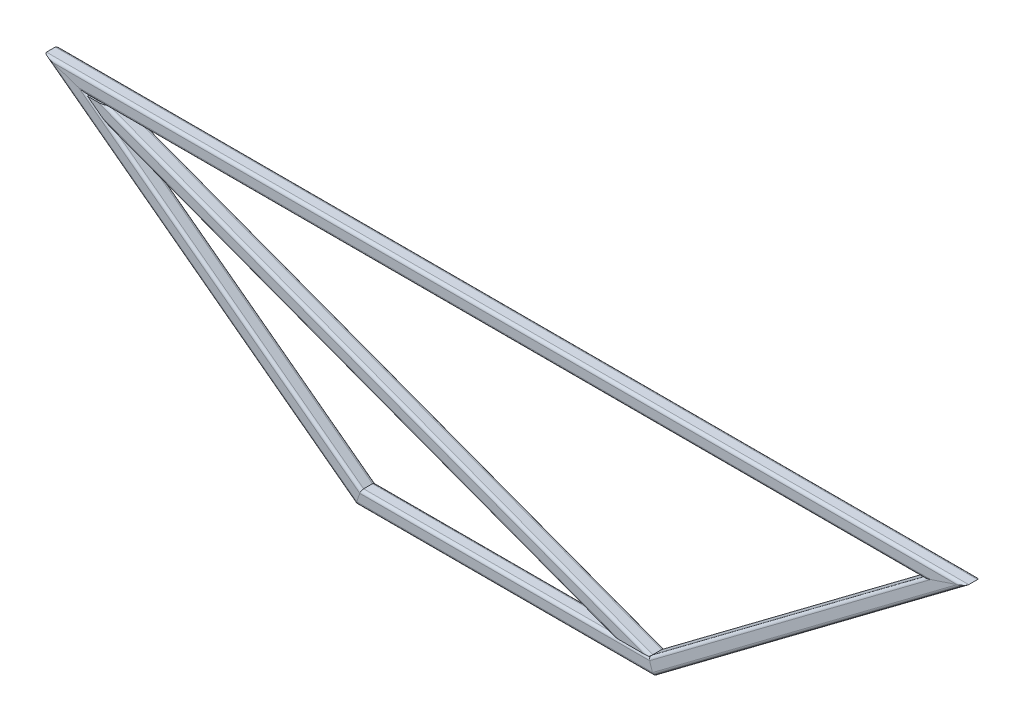
from build123d import *

# Parameters (mm, degrees)
SQUARE_TUBE_20_X_20_X_2_2_DEPTH      = 1243.426406871
SQUARE_TUBE_20_X_20_X_2_2_DEPTH_BACK = 43.426406871
SQUARE_TUBE_20_X_20_X_2_2_2_DEPTH    = 549.140452079
SQUARE_TUBE_20_X_20_X_2_2_3_DEPTH    = 411.428090416
SQUARE_TUBE_20_X_20_X_2_2_4_DEPTH    = 549.140452079
SQUARE_TUBE_20_X_20_X_2_1_DEPTH      = 854.400374532


with BuildPart() as part:
    # Sketch15 → Square tube 20 X 20 X 2(2) (new, two sides: drawn at the far end of the back side and taken through both)
    with BuildSketch(Plane(origin=(600, 0, 0), x_dir=(0, -1, 0), z_dir=(-1, 0, 0)).offset(-SQUARE_TUBE_20_X_20_X_2_2_DEPTH_BACK)):
        with BuildLine():
            Line((-6, -10), (6, -10))
            ThreePointArc((6, -10), (8.828427125, -8.828427125), (10, -6))
            Line((10, -6), (10, 6))
            ThreePointArc((10, 6), (8.828427125, 8.828427125), (6, 10))
            Line((6, 10), (-6, 10))
            ThreePointArc((-6, 10), (-8.828427125, 8.828427125), (-10, 6))
            Line((-10, 6), (-10, -6))
            ThreePointArc((-10, -6), (-8.828427125, -8.828427125), (-6, -10))
        make_face()
        with BuildLine():
            Line((-6, -8), (6, -8))
            ThreePointArc((6, -8), (7.414213562, -7.414213562), (8, -6))
            Line((8, -6), (8, 6))
            ThreePointArc((8, 6), (7.414213562, 7.414213562), (6, 8))
            Line((6, 8), (-6, 8))
            ThreePointArc((-6, 8), (-7.414213562, 7.414213562), (-8, 6))
            Line((-8, 6), (-8, -6))
            ThreePointArc((-8, -6), (-7.414213562, -7.414213562), (-6, -8))
        make_face(mode=Mode.SUBTRACT)
    extrude(amount=SQUARE_TUBE_20_X_20_X_2_2_DEPTH + SQUARE_TUBE_20_X_20_X_2_2_DEPTH_BACK)

    # Square tube 20 X 20 X 2(2) mitre 1
    split(bisect_by=Plane(origin=(600, 0, 0), x_dir=(-0.948683298, -0.316227766, 0), z_dir=(-0.316227766, 0.948683298, 0)), keep=Keep.TOP)

    # Square tube 20 X 20 X 2(2) mitre 2
    split(bisect_by=Plane(origin=(-600, 0, 0), x_dir=(-0.948683298, 0.316227766, 0), z_dir=(0.316227766, 0.948683298, 0)), keep=Keep.TOP)


with BuildPart() as body_2:
    # Sketch15 on segment 2 (carried to segment 2) → Square tube 20 X 20 X 2_2 2 (new body)
    with BuildSketch(Plane(origin=(-634.741125497, 26.055844123, 0), x_dir=(0.6, 0.8, 0), z_dir=(0.8, -0.6, 0))):
        with BuildLine():
            Line((-6, -10), (6, -10))
            ThreePointArc((6, -10), (8.828427125, -8.828427125), (10, -6))
            Line((10, -6), (10, 6))
            ThreePointArc((10, 6), (8.828427125, 8.828427125), (6, 10))
            Line((6, 10), (-6, 10))
            ThreePointArc((-6, 10), (-8.828427125, 8.828427125), (-10, 6))
            Line((-10, 6), (-10, -6))
            ThreePointArc((-10, -6), (-8.828427125, -8.828427125), (-6, -10))
        make_face()
        with BuildLine():
            Line((-6, -8), (6, -8))
            ThreePointArc((6, -8), (7.414213562, -7.414213562), (8, -6))
            Line((8, -6), (8, 6))
            ThreePointArc((8, 6), (7.414213562, 7.414213562), (6, 8))
            Line((6, 8), (-6, 8))
            ThreePointArc((-6, 8), (-7.414213562, 7.414213562), (-8, 6))
            Line((-8, 6), (-8, -6))
            ThreePointArc((-8, -6), (-7.414213562, -7.414213562), (-6, -8))
        make_face(mode=Mode.SUBTRACT)
    extrude(amount=SQUARE_TUBE_20_X_20_X_2_2_2_DEPTH)

    # Square tube 20 X 20 X 2_2 2 mitre 1
    split(bisect_by=Plane(origin=(-600, 0, 0), x_dir=(0.948683298, -0.316227766, 0), z_dir=(-0.316227766, -0.948683298, 0)), keep=Keep.TOP)

    # Square tube 20 X 20 X 2_2 2 mitre 2
    split(bisect_by=Plane(origin=(-200, -300, 0), x_dir=(-0.316227766, -0.948683298, 0), z_dir=(-0.948683298, 0.316227766, 0)), keep=Keep.TOP)


with BuildPart() as body_3:
    # Sketch15 on segment 3 (carried to segment 3) → Square tube 20 X 20 X 2_2 3 (new body)
    with BuildSketch(Plane(origin=(-205.714045208, -300, 0), x_dir=(0, 1, 0), z_dir=(1, 0, 0))):
        with BuildLine():
            Line((-6, -10), (6, -10))
            ThreePointArc((6, -10), (8.828427125, -8.828427125), (10, -6))
            Line((10, -6), (10, 6))
            ThreePointArc((10, 6), (8.828427125, 8.828427125), (6, 10))
            Line((6, 10), (-6, 10))
            ThreePointArc((-6, 10), (-8.828427125, 8.828427125), (-10, 6))
            Line((-10, 6), (-10, -6))
            ThreePointArc((-10, -6), (-8.828427125, -8.828427125), (-6, -10))
        make_face()
        with BuildLine():
            Line((-6, -8), (6, -8))
            ThreePointArc((6, -8), (7.414213562, -7.414213562), (8, -6))
            Line((8, -6), (8, 6))
            ThreePointArc((8, 6), (7.414213562, 7.414213562), (6, 8))
            Line((6, 8), (-6, 8))
            ThreePointArc((-6, 8), (-7.414213562, 7.414213562), (-8, 6))
            Line((-8, 6), (-8, -6))
            ThreePointArc((-8, -6), (-7.414213562, -7.414213562), (-6, -8))
        make_face(mode=Mode.SUBTRACT)
    extrude(amount=SQUARE_TUBE_20_X_20_X_2_2_3_DEPTH)

    # Square tube 20 X 20 X 2_2 3 mitre 1
    split(bisect_by=Plane(origin=(-200, -300, 0), x_dir=(0.316227766, 0.948683298, 0), z_dir=(0.948683298, -0.316227766, 0)), keep=Keep.TOP)

    # Square tube 20 X 20 X 2_2 3 mitre 2
    split(bisect_by=Plane(origin=(200, -300, 0), x_dir=(0.316227766, -0.948683298, 0), z_dir=(-0.948683298, -0.316227766, 0)), keep=Keep.TOP)


with BuildPart() as body_4:
    # Sketch15 on segment 4 (carried to segment 4) → Square tube 20 X 20 X 2_2 4 (new body)
    with BuildSketch(Plane(origin=(195.428763834, -303.428427125, 0), x_dir=(-0.6, 0.8, 0), z_dir=(0.8, 0.6, 0))):
        with BuildLine():
            Line((-6, -10), (6, -10))
            ThreePointArc((6, -10), (8.828427125, -8.828427125), (10, -6))
            Line((10, -6), (10, 6))
            ThreePointArc((10, 6), (8.828427125, 8.828427125), (6, 10))
            Line((6, 10), (-6, 10))
            ThreePointArc((-6, 10), (-8.828427125, 8.828427125), (-10, 6))
            Line((-10, 6), (-10, -6))
            ThreePointArc((-10, -6), (-8.828427125, -8.828427125), (-6, -10))
        make_face()
        with BuildLine():
            Line((-6, -8), (6, -8))
            ThreePointArc((6, -8), (7.414213562, -7.414213562), (8, -6))
            Line((8, -6), (8, 6))
            ThreePointArc((8, 6), (7.414213562, 7.414213562), (6, 8))
            Line((6, 8), (-6, 8))
            ThreePointArc((-6, 8), (-7.414213562, 7.414213562), (-8, 6))
            Line((-8, 6), (-8, -6))
            ThreePointArc((-8, -6), (-7.414213562, -7.414213562), (-6, -8))
        make_face(mode=Mode.SUBTRACT)
    extrude(amount=SQUARE_TUBE_20_X_20_X_2_2_4_DEPTH)

    # Square tube 20 X 20 X 2_2 4 mitre 1
    split(bisect_by=Plane(origin=(200, -300, 0), x_dir=(-0.316227766, 0.948683298, 0), z_dir=(0.948683298, 0.316227766, 0)), keep=Keep.TOP)

    # Square tube 20 X 20 X 2_2 4 mitre 2
    split(bisect_by=Plane(origin=(600, 0, 0), x_dir=(0.948683298, 0.316227766, 0), z_dir=(0.316227766, -0.948683298, 0)), keep=Keep.TOP)


with BuildPart() as body_5:
    # Sketch16 → Square tube 20 X 20 X 2(1) (new body)
    with BuildSketch(Plane(origin=(-600, 0, 0), x_dir=(0.35112344158839154, 0.9363291775690447, 0), z_dir=(0.9363291775690447, -0.35112344158839154, 0))):
        with BuildLine():
            Line((-6, -10), (6, -10))
            ThreePointArc((6, -10), (8.828427125, -8.828427125), (10, -6))
            Line((10, -6), (10, 6))
            ThreePointArc((10, 6), (8.828427125, 8.828427125), (6, 10))
            Line((6, 10), (-6, 10))
            ThreePointArc((-6, 10), (-8.828427125, 8.828427125), (-10, 6))
            Line((-10, 6), (-10, -6))
            ThreePointArc((-10, -6), (-8.828427125, -8.828427125), (-6, -10))
        make_face()
        with BuildLine():
            Line((-6, -8), (6, -8))
            ThreePointArc((6, -8), (7.414213562, -7.414213562), (8, -6))
            Line((8, -6), (8, 6))
            ThreePointArc((8, 6), (7.414213562, 7.414213562), (6, 8))
            Line((6, 8), (-6, 8))
            ThreePointArc((-6, 8), (-7.414213562, 7.414213562), (-8, 6))
            Line((-8, 6), (-8, -6))
            ThreePointArc((-8, -6), (-7.414213562, -7.414213562), (-6, -8))
        make_face(mode=Mode.SUBTRACT)
    extrude(amount=SQUARE_TUBE_20_X_20_X_2_1_DEPTH)

    # Trim/Extend1
    split(bisect_by=Plane.XZ.offset(10), keep=Keep.TOP)

    # Trim_Extend1 3
    split(bisect_by=Plane(origin=(-383.333333333, -150, 0), x_dir=(-0.8, 0.6, 0), z_dir=(0.6, 0.8, 0)), keep=Keep.TOP)

    # Trim_Extend1 5
    split(bisect_by=Plane(origin=(383.333333334, -150, 0), x_dir=(-0.8, -0.6, 0), z_dir=(-0.6, 0.8, 0)), keep=Keep.TOP)

    # Trim_Extend1 7
    split(bisect_by=Plane(origin=(0, -290, 0), x_dir=(-1, 0, 0), z_dir=(0, 1, 0)), keep=Keep.TOP)


solid = Compound([part.part, body_2.part, body_3.part, body_4.part, body_5.part])
